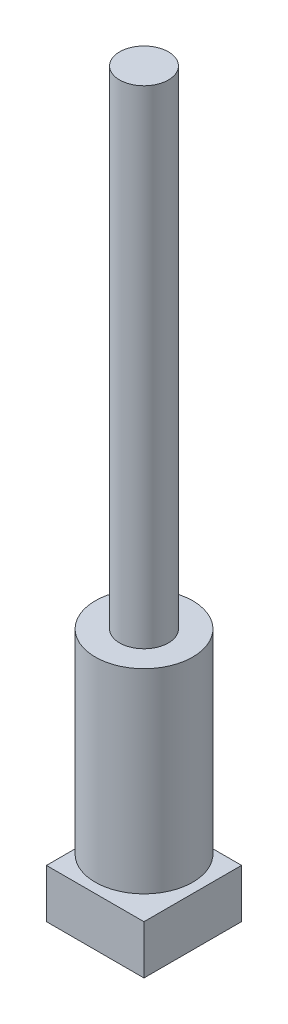
from build123d import *

# Parameters (mm, degrees)
SKETCH_2_W      = 100
SKETCH_2_H      = 100.088773616
EXTRUDE_1_DEPTH = 50


with BuildPart() as part:
    # 草图1 → 旋转1 (revolve)
    with BuildSketch(Plane.XY, mode=Mode.PRIVATE) as revolve_1_sk:
        Polygon((-25, 0), (-25, 500), (0, 500), (0, 0), (0, -200), (-50, -200), (-50, 0), align=None)
    revolve(revolve_1_sk.sketch.rotate(Axis((0, 0, 0), (0, 1, 0)), 270), axis=Axis((0, 0, 0), (0, 1, 0)))


with BuildPart() as body_2:
    # 草图2 → 凸台-拉伸1 (new body)
    with BuildSketch(Plane(origin=(0, -210, 0), x_dir=(-1, 0, 0), z_dir=(0, -1, 0))):
        Rectangle(SKETCH_2_W, SKETCH_2_H)
    extrude(amount=EXTRUDE_1_DEPTH)


solid = Compound([part.part, body_2.part])
